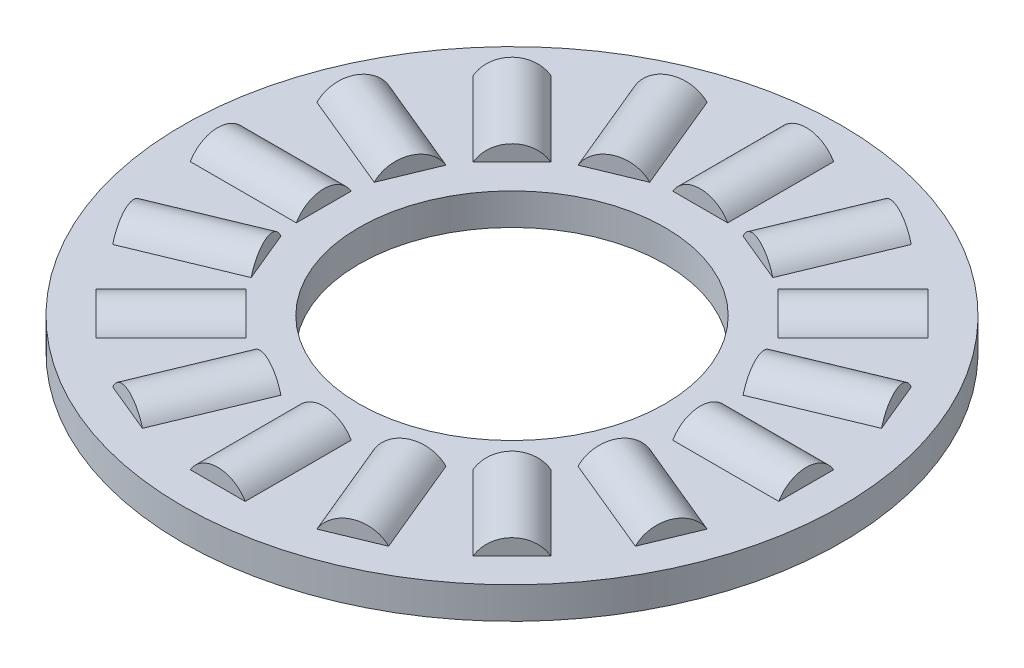
from build123d import *

# Parameters (mm, degrees)
SKETCH5_W         = 5.53085
SKETCH5_H         = 0.9921875
SKETCH3_W         = 3.31851
SKETCH3_H         = 0.9921875
SKETCH2_W         = 3.31851
SKETCH2_H         = 0.9921875
CIRPATTERN1_COUNT = 16
CIRPATTERN1_ANGLE = 337.5
CIRPATTERN2_COUNT = 16


with BuildPart() as part:
    # Sketch5 → Revolve3 (revolve)
    with BuildSketch(Plane(origin=(0, 0, 0), x_dir=(0, 0, -1), z_dir=(1, 0, 0)), mode=Mode.PRIVATE) as revolve3_sk:
        with Locations((-7.553325, 0)):
            Rectangle(SKETCH5_W, SKETCH5_H)
    revolve(revolve3_sk.sketch.rotate(Axis((0, -0.9921875, 0), (0, 1, 0)), 180), axis=Axis((0, -0.9921875, 0), (0, 1, 0)))

    # Sketch3 → Cut-Revolve1 (revolve, cut)
    with BuildSketch(Plane(origin=(0, 0, 0), x_dir=(0, 0, -1), z_dir=(1, 0, 0))):
        with Locations((-7.553325, 0.49609375)):
            Rectangle(SKETCH3_W, SKETCH3_H)
    cut_revolve1 = revolve(axis=Axis((0, 0, 9.21258), (0, 0, -1)), mode=Mode.SUBTRACT)

    # CirPattern2: Cut-Revolve1 ×16 about axis
    cirpattern2_axis = Axis((0, 0, 0), (0, 1, 0))
    for i in range(1, CIRPATTERN2_COUNT):
        add(cut_revolve1.rotate(cirpattern2_axis, i * 360 / CIRPATTERN2_COUNT), mode=Mode.SUBTRACT)


with BuildPart() as body_2:
    # Sketch2 → Revolve2 (revolve)
    with BuildSketch(Plane(origin=(0, 0, 0), x_dir=(0, 0, -1), z_dir=(1, 0, 0)), mode=Mode.PRIVATE) as revolve2_sk:
        with Locations((-7.553325, 0.49609375)):
            Rectangle(SKETCH2_W, SKETCH2_H)
    revolve(revolve2_sk.sketch.rotate(Axis((0, 0, 9.21258), (0, 0, -1)), 90), axis=Axis((0, 0, 9.21258), (0, 0, -1)))


with BuildPart() as cirpattern1_1:
    # CirPattern1: pattern copy
    add(body_2.part.rotate(Axis((0, 0.9921875, 0), (0, -1, 0)), 1 * CIRPATTERN1_ANGLE / (CIRPATTERN1_COUNT - 1)))


with BuildPart() as cirpattern1_2:
    # CirPattern1: pattern copy
    add(body_2.part.rotate(Axis((0, 0.9921875, 0), (0, -1, 0)), 2 * CIRPATTERN1_ANGLE / (CIRPATTERN1_COUNT - 1)))


with BuildPart() as cirpattern1_3:
    # CirPattern1: pattern copy
    add(body_2.part.rotate(Axis((0, 0.9921875, 0), (0, -1, 0)), 3 * CIRPATTERN1_ANGLE / (CIRPATTERN1_COUNT - 1)))


with BuildPart() as cirpattern1_4:
    # CirPattern1: pattern copy
    add(body_2.part.rotate(Axis((0, 0.9921875, 0), (0, -1, 0)), 4 * CIRPATTERN1_ANGLE / (CIRPATTERN1_COUNT - 1)))


with BuildPart() as cirpattern1_5:
    # CirPattern1: pattern copy
    add(body_2.part.rotate(Axis((0, 0.9921875, 0), (0, -1, 0)), 5 * CIRPATTERN1_ANGLE / (CIRPATTERN1_COUNT - 1)))


with BuildPart() as cirpattern1_6:
    # CirPattern1: pattern copy
    add(body_2.part.rotate(Axis((0, 0.9921875, 0), (0, -1, 0)), 6 * CIRPATTERN1_ANGLE / (CIRPATTERN1_COUNT - 1)))


with BuildPart() as cirpattern1_7:
    # CirPattern1: pattern copy
    add(body_2.part.rotate(Axis((0, 0.9921875, 0), (0, -1, 0)), 7 * CIRPATTERN1_ANGLE / (CIRPATTERN1_COUNT - 1)))


with BuildPart() as cirpattern1_8:
    # CirPattern1: pattern copy
    add(body_2.part.rotate(Axis((0, 0.9921875, 0), (0, -1, 0)), 8 * CIRPATTERN1_ANGLE / (CIRPATTERN1_COUNT - 1)))


with BuildPart() as cirpattern1_9:
    # CirPattern1: pattern copy
    add(body_2.part.rotate(Axis((0, 0.9921875, 0), (0, -1, 0)), 9 * CIRPATTERN1_ANGLE / (CIRPATTERN1_COUNT - 1)))


with BuildPart() as cirpattern1_10:
    # CirPattern1: pattern copy
    add(body_2.part.rotate(Axis((0, 0.9921875, 0), (0, -1, 0)), 10 * CIRPATTERN1_ANGLE / (CIRPATTERN1_COUNT - 1)))


with BuildPart() as cirpattern1_11:
    # CirPattern1: pattern copy
    add(body_2.part.rotate(Axis((0, 0.9921875, 0), (0, -1, 0)), 11 * CIRPATTERN1_ANGLE / (CIRPATTERN1_COUNT - 1)))


with BuildPart() as cirpattern1_12:
    # CirPattern1: pattern copy
    add(body_2.part.rotate(Axis((0, 0.9921875, 0), (0, -1, 0)), 12 * CIRPATTERN1_ANGLE / (CIRPATTERN1_COUNT - 1)))


with BuildPart() as cirpattern1_13:
    # CirPattern1: pattern copy
    add(body_2.part.rotate(Axis((0, 0.9921875, 0), (0, -1, 0)), 13 * CIRPATTERN1_ANGLE / (CIRPATTERN1_COUNT - 1)))


with BuildPart() as cirpattern1_14:
    # CirPattern1: pattern copy
    add(body_2.part.rotate(Axis((0, 0.9921875, 0), (0, -1, 0)), 14 * CIRPATTERN1_ANGLE / (CIRPATTERN1_COUNT - 1)))


with BuildPart() as cirpattern1_15:
    # CirPattern1: pattern copy
    add(body_2.part.rotate(Axis((0, 0.9921875, 0), (0, -1, 0)), 15 * CIRPATTERN1_ANGLE / (CIRPATTERN1_COUNT - 1)))


solid = Compound([part.part, body_2.part, cirpattern1_1.part, cirpattern1_2.part, cirpattern1_3.part, cirpattern1_4.part, cirpattern1_5.part, cirpattern1_6.part, cirpattern1_7.part, cirpattern1_8.part, cirpattern1_9.part, cirpattern1_10.part, cirpattern1_11.part, cirpattern1_12.part, cirpattern1_13.part, cirpattern1_14.part, cirpattern1_15.part])
